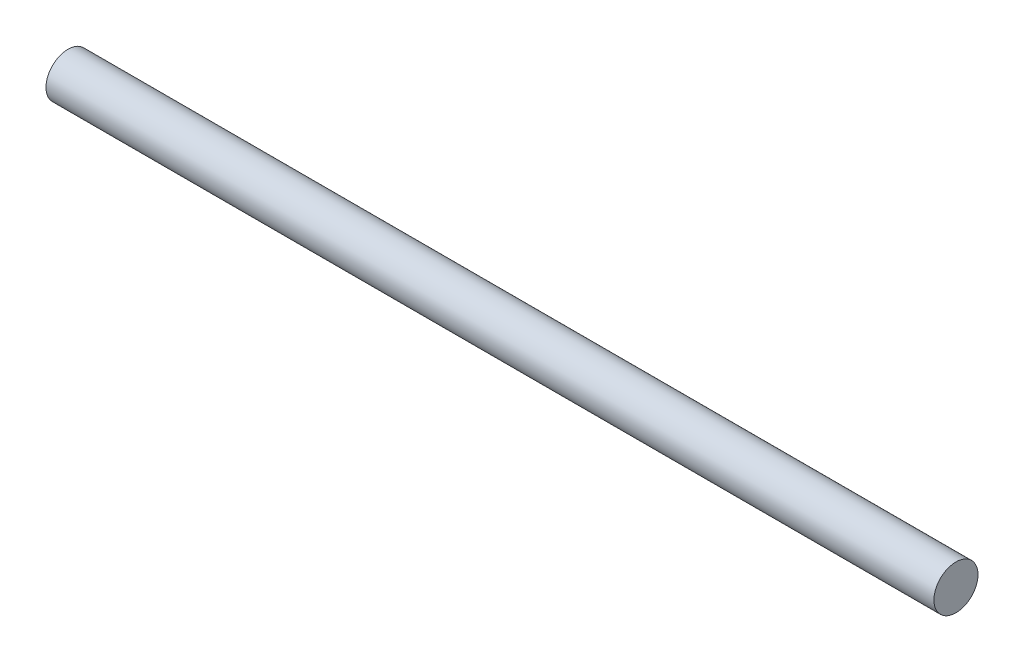
from build123d import *

# Parameters (mm, degrees)
ESQUISSE1_R        = 3.5
BOSS_EXTRU_1_DEPTH = 141


with BuildPart() as part:
    # Esquisse1 → Boss.-Extru.1 (new body)
    with BuildSketch(Plane(origin=(0, 0, 0), x_dir=(0, 0, -1), z_dir=(1, 0, 0))):
        Circle(ESQUISSE1_R)
    extrude(amount=BOSS_EXTRU_1_DEPTH)


solid = part.part
